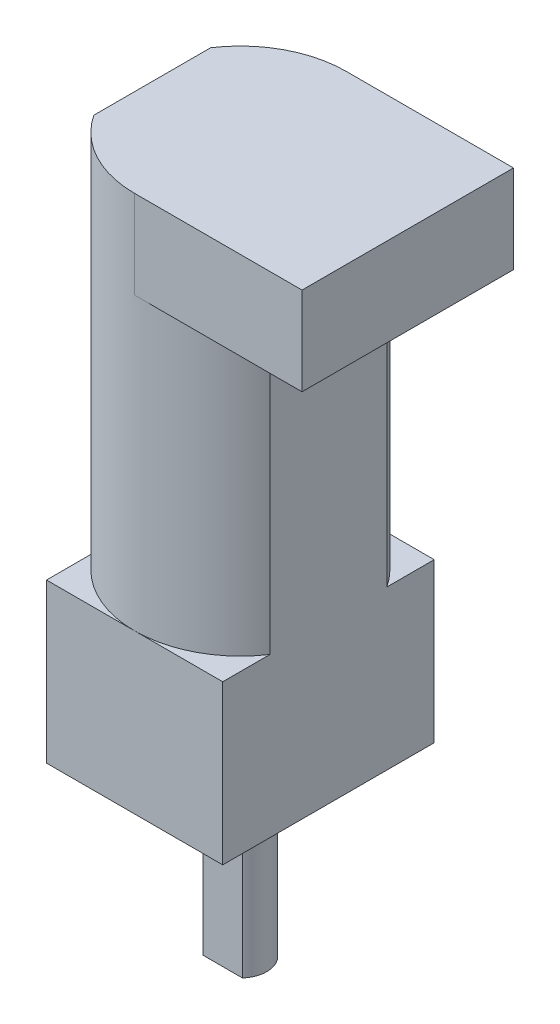
from build123d import *

# Parameters (mm, degrees)
EXTRUDE_1_DEPTH = 21.5
SKETCH_2_W      = 9.5
SKETCH_2_H      = 12
EXTRUDE_2_DEPTH = 5
SKETCH_3_W      = 10
SKETCH_3_H      = 12
EXTRUDE_3_DEPTH = 9
SKETCH_4_R      = 2
EXTRUDE_4_DEPTH = 0.7
EXTRUDE_6_DEPTH = 9.3


with BuildPart() as part:
    # 草图1 → 凸台-拉伸1 (new body)
    with BuildSketch(Plane(origin=(0, 0, 0), x_dir=(1, 0, 0), z_dir=(0, 1, 0))):
        with BuildLine():
            Line((-5, -3.31662479), (-5, 3.31662479))
            ThreePointArc((-5, 3.31662479), (0, 6), (5, 3.31662479))
            Line((5, 3.31662479), (5, -3.31662479))
            ThreePointArc((5, -3.31662479), (0, -6), (-5, -3.31662479))
        make_face()
    extrude(amount=EXTRUDE_1_DEPTH)

    # 草图2 → 凸台-拉伸2 (add)
    with BuildSketch(Plane(origin=(0, 21.5, 0), x_dir=(1, 0, 0), z_dir=(0, 1, 0))):
        with Locations((4.75, 0)):
            Rectangle(SKETCH_2_W, SKETCH_2_H)
    extrude(amount=-EXTRUDE_2_DEPTH)

    # 草图3 → 凸台-拉伸3 (add)
    with BuildSketch(Plane.XZ):
        Rectangle(SKETCH_3_W, SKETCH_3_H)
    extrude(amount=EXTRUDE_3_DEPTH)

    # 草图4 → 凸台-拉伸4 (add)
    with BuildSketch(Plane.XZ.offset(9)):
        with Locations(Location((0, 0, 0), (0, 0, 270))):
            Circle(SKETCH_4_R)
    extrude(amount=EXTRUDE_4_DEPTH)

    # 草图5 → 凸台-拉伸6 (add)
    with BuildSketch(Plane.XZ.offset(9.7)):
        with BuildLine():
            Line((-1.118033989, 1), (1.118033989, 1))
            ThreePointArc((1.118033989, 1), (0, -1.5), (-1.118033989, 1))
        make_face()
    extrude(amount=EXTRUDE_6_DEPTH)


solid = part.part
